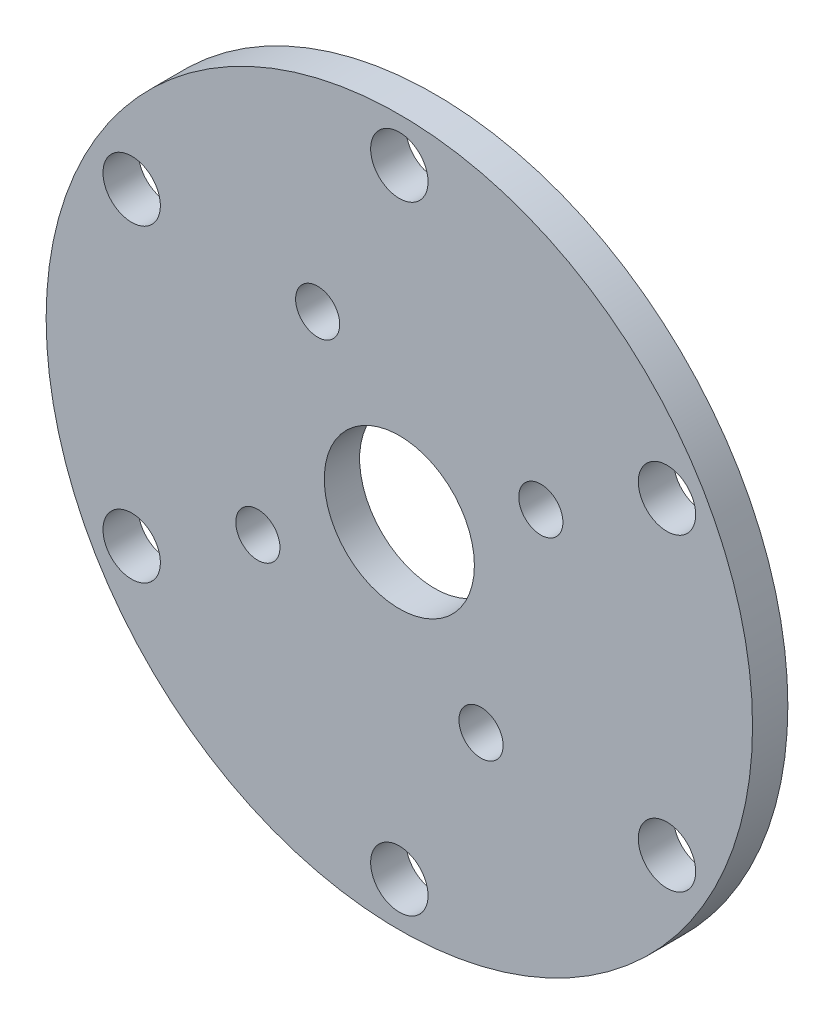
from build123d import *

# Parameters (mm, degrees)
SKETCH_1_R      = 40
SKETCH_1_R_2    = 3.25
SKETCH_1_R_3    = 8.5
SKETCH_1_R_4    = 2.5
EXTRUDE_1_DEPTH = 4


with BuildPart() as part:
    # 草图1 → 凸台-拉伸1 (new body)
    with BuildSketch(Plane.XY):
        Circle(SKETCH_1_R)
        with Locations((0, 35)):
            Circle(SKETCH_1_R_2, mode=Mode.SUBTRACT)
        with Locations((30.310889132, 17.5)):
            Circle(SKETCH_1_R_2, mode=Mode.SUBTRACT)
        with Locations((30.310889132, -17.5)):
            Circle(SKETCH_1_R_2, mode=Mode.SUBTRACT)
        with Locations((0, -35)):
            Circle(SKETCH_1_R_2, mode=Mode.SUBTRACT)
        with Locations((-30.310889132, -17.5)):
            Circle(SKETCH_1_R_2, mode=Mode.SUBTRACT)
        with Locations((-30.310889132, 17.5)):
            Circle(SKETCH_1_R_2, mode=Mode.SUBTRACT)
        Circle(SKETCH_1_R_3, mode=Mode.SUBTRACT)
        with Locations((-9.25, 16.02146997)):
            Circle(SKETCH_1_R_4, mode=Mode.SUBTRACT)
        with Locations((16.02146997, 9.25)):
            Circle(SKETCH_1_R_4, mode=Mode.SUBTRACT)
        with Locations((9.25, -16.02146997)):
            Circle(SKETCH_1_R_4, mode=Mode.SUBTRACT)
        with Locations((-16.02146997, -9.25)):
            Circle(SKETCH_1_R_4, mode=Mode.SUBTRACT)
    extrude(amount=EXTRUDE_1_DEPTH)


solid = part.part
